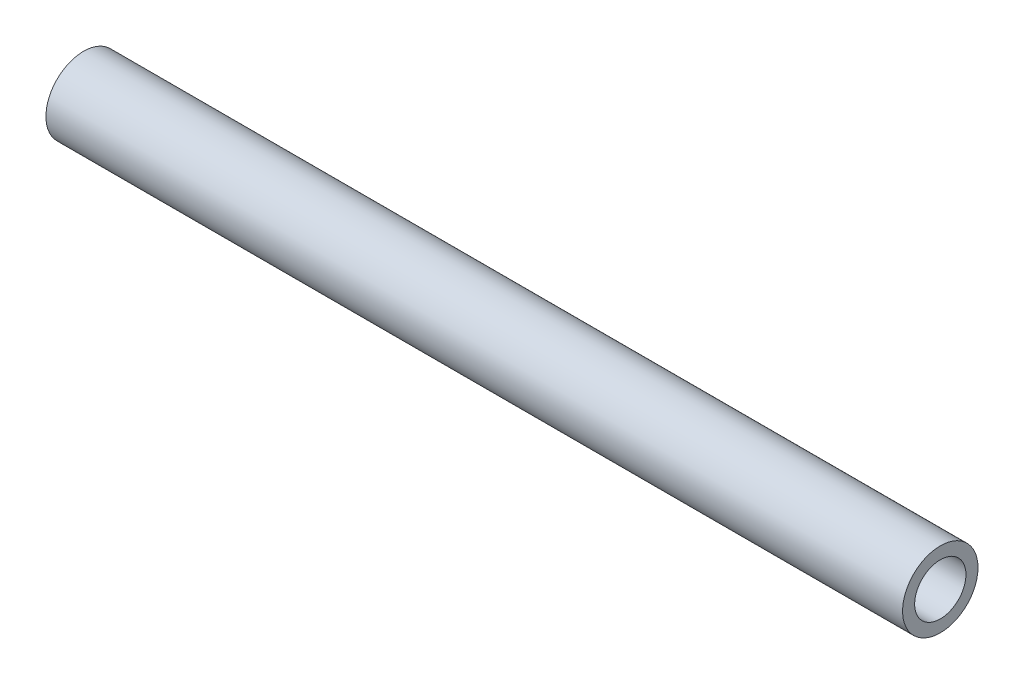
from build123d import *

# Parameters (mm, degrees)
SKETCH1_R           = 6.25
SKETCH1_R_2         = 4.25
BOSS_EXTRUDE1_DEPTH = 142


with BuildPart() as part:
    # Sketch1 → Boss-Extrude1 (new body)
    with BuildSketch(Plane(origin=(0, 0, 0), x_dir=(0, 0, -1), z_dir=(1, 0, 0))):
        Circle(SKETCH1_R)
        Circle(SKETCH1_R_2, mode=Mode.SUBTRACT)
    extrude(amount=BOSS_EXTRUDE1_DEPTH)


solid = part.part
